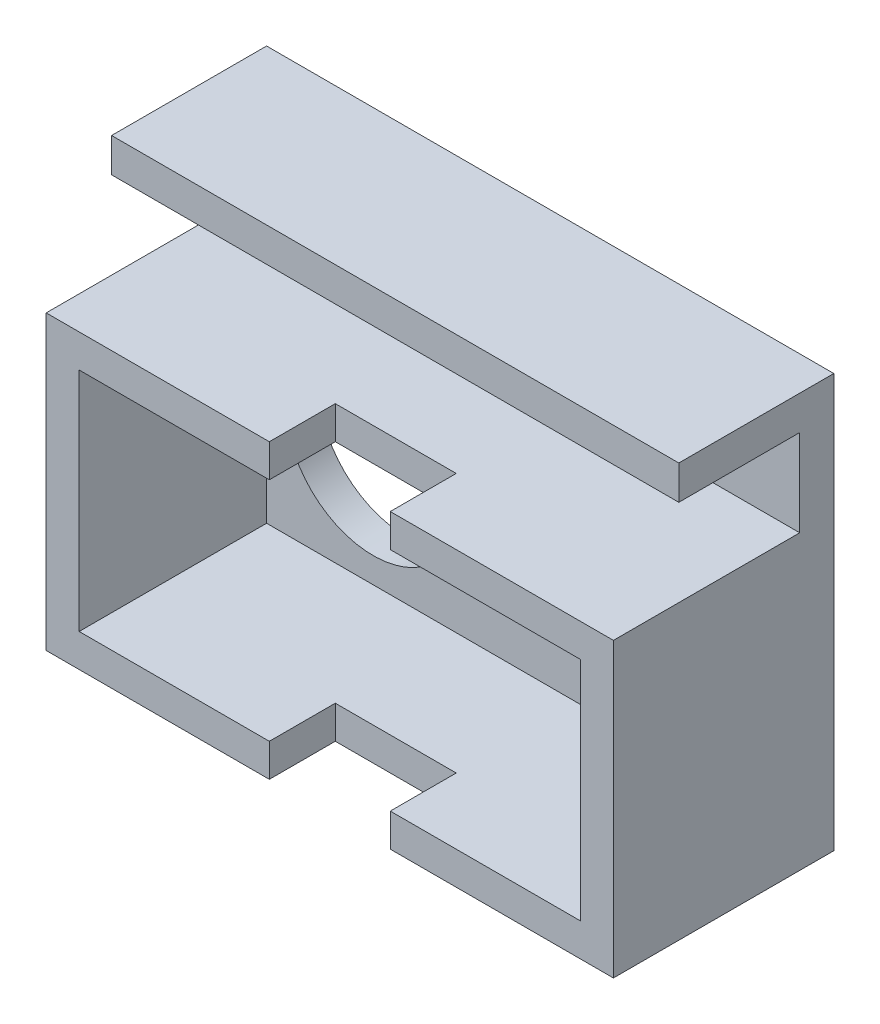
from build123d import *

# Parameters (mm, degrees)
SKETCH1_W           = 51.6
SKETCH1_H           = 26.6
BOSS_EXTRUDE1_DEPTH = 23.05
CUT_EXTRUDE1_DEPTH  = 4
SKETCH3_W           = 45.6
SKETCH3_H           = 20.6
CUT_EXTRUDE2_DEPTH  = 16.05
SKETCH4_R           = 8
CUT_EXTRUDE3_DEPTH  = 3.1
SKETCH6_W           = 51.6
SKETCH6_H           = 3.1
BOSS_EXTRUDE2_DEPTH = 11
SKETCH7_W           = 51.6
SKETCH7_H           = 3.1
BOSS_EXTRUDE3_DEPTH = 11
SKETCH8_W           = 11
SKETCH8_H           = 26.6
CUT_EXTRUDE4_DEPTH  = 5
SKETCH9_W           = 51.6
SKETCH9_H           = 26.6
CUT_EXTRUDE5_DEPTH  = 5
BOSS_EXTRUDE4_DEPTH = 2


with BuildPart() as part:
    # Sketch1 → Boss-Extrude1 (new body)
    with BuildSketch(Plane.XY):
        with Locations((25.8, 13.3)):
            Rectangle(SKETCH1_W, SKETCH1_H)
    extrude(amount=BOSS_EXTRUDE1_DEPTH)

    # Sketch2 → Cut-Extrude1 (cut)
    with BuildSketch(Plane.XY.offset(23.05)):
        Polygon((20.3, 3), (20.3, 0), (31.3, 0), (31.3, 3), (48.6, 3), (48.6, 23.6), (31.3, 23.6), (31.3, 26.6), (20.3, 26.6), (20.3, 23.6), (3, 23.6), (3, 3), align=None)
    extrude(amount=-CUT_EXTRUDE1_DEPTH, mode=Mode.SUBTRACT)

    # Sketch3 → Cut-Extrude2 (cut)
    with BuildSketch(Plane.XY.offset(19.05)):
        with Locations((25.8, 13.3)):
            Rectangle(SKETCH3_W, SKETCH3_H)
    extrude(amount=-CUT_EXTRUDE2_DEPTH, mode=Mode.SUBTRACT)

    # Sketch4 → Cut-Extrude3 (cut)
    with BuildSketch(Plane(origin=(0, 0, 0), x_dir=(-1, 0, 0), z_dir=(0, 0, -1))):
        with Locations((-12.7, 13.3)):
            Circle(SKETCH4_R)
        with Locations((-38.9, 13.3)):
            Circle(SKETCH4_R)
    extrude(amount=-CUT_EXTRUDE3_DEPTH, mode=Mode.SUBTRACT)

    # Sketch6 → Boss-Extrude2 (add)
    with BuildSketch(Plane(origin=(0, 26.6, 0), x_dir=(1, 0, 0), z_dir=(0, 1, 0))):
        with Locations((25.8, -1.55)):
            Rectangle(SKETCH6_W, SKETCH6_H)
    extrude(amount=BOSS_EXTRUDE2_DEPTH)

    # Sketch7 → Boss-Extrude3 (add)
    with BuildSketch(Plane.XY.offset(3.1)):
        with Locations((25.8, 36.05)):
            Rectangle(SKETCH7_W, SKETCH7_H)
    extrude(amount=BOSS_EXTRUDE3_DEPTH)

    # Sketch8 → Cut-Extrude4 (cut)
    with BuildSketch(Plane.XY.offset(19.05)):
        with Locations((25.8, 13.3)):
            Rectangle(SKETCH8_W, SKETCH8_H)
    extrude(amount=-CUT_EXTRUDE4_DEPTH, mode=Mode.SUBTRACT)

    # Sketch9 → Cut-Extrude5 (cut)
    with BuildSketch(Plane.XY.offset(23.05)):
        with Locations((25.8, 13.3)):
            Rectangle(SKETCH9_W, SKETCH9_H)
    extrude(amount=-CUT_EXTRUDE5_DEPTH, mode=Mode.SUBTRACT)

    # Sketch10 → Boss-Extrude4 (add)
    with BuildSketch(Plane.XY.offset(18.05)):
        Polygon((0, 0), (20.3, 0), (20.3, 3), (3, 3), (3, 23.6), (20.3, 23.6), (20.3, 26.6), (0, 26.6), align=None)
        Polygon((31.3, 0), (51.6, 0), (51.6, 26.6), (31.3, 26.6), (31.3, 23.6), (48.6, 23.6), (48.6, 3), (31.3, 3), align=None)
    extrude(amount=BOSS_EXTRUDE4_DEPTH)


solid = part.part
